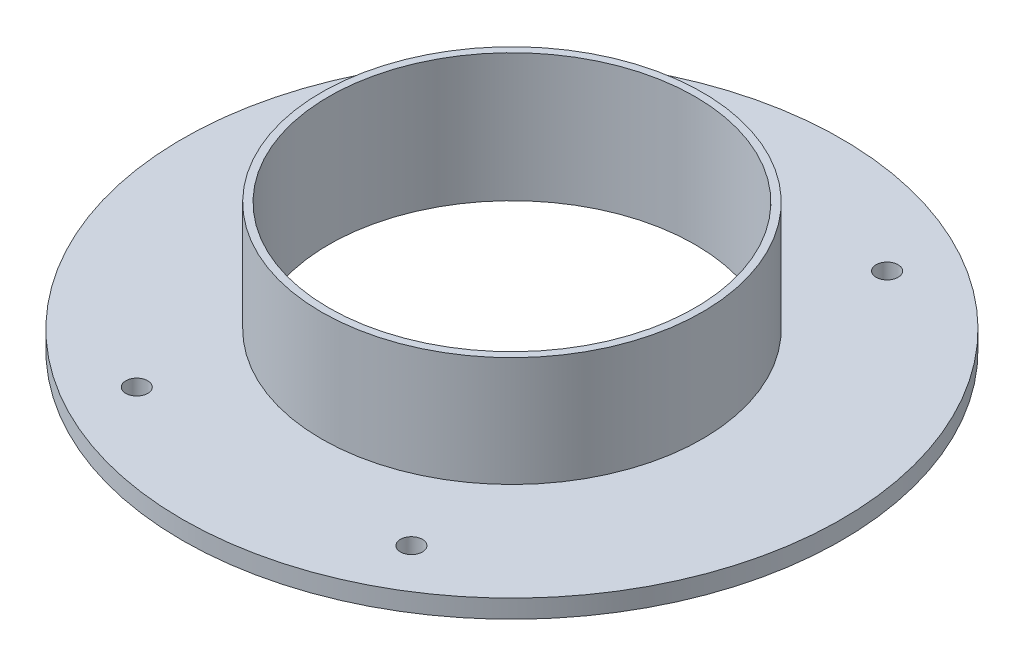
from build123d import *

# Parameters (mm, degrees)
SKETCH1_R           = 90
SKETCH1_R_2         = 50
SKETCH1_R_3         = 3
BOSS_EXTRUDE1_DEPTH = 5
SKETCH2_R           = 52
SKETCH2_R_2         = 50
BOSS_EXTRUDE2_DEPTH = 30


with BuildPart() as part:
    # Sketch1 → Boss-Extrude1 (new body)
    with BuildSketch(Plane(origin=(0, 0, 0), x_dir=(1, 0, 0), z_dir=(0, 1, 0))):
        with Locations(Location((0, 0, 0), (0, 0, 270))):
            Circle(SKETCH1_R)
        with Locations(Location((0, 0, 0), (0, 0, 270))):
            Circle(SKETCH1_R_2, mode=Mode.SUBTRACT)
        with Locations(Location((37.5, 64.951905284, 0), (0, 0, 270))):
            Circle(SKETCH1_R_3, mode=Mode.SUBTRACT)
        with Locations(Location((-37.5, 64.951905284, 0), (0, 0, 90))):
            Circle(SKETCH1_R_3, mode=Mode.SUBTRACT)
        with Locations(Location((37.5, -64.951905284, 0), (0, 0, 90))):
            Circle(SKETCH1_R_3, mode=Mode.SUBTRACT)
        with Locations(Location((-37.5, -64.951905284, 0), (0, 0, 270))):
            Circle(SKETCH1_R_3, mode=Mode.SUBTRACT)
    extrude(amount=BOSS_EXTRUDE1_DEPTH)

    # Sketch2 → Boss-Extrude2 (add)
    with BuildSketch(Plane(origin=(0, 5, 0), x_dir=(1, 0, 0), z_dir=(0, 1, 0))):
        with Locations(Location((0, 0, 0), (0, 0, 270))):
            Circle(SKETCH2_R)
        with Locations(Location((0, 0, 0), (0, 0, 270))):
            Circle(SKETCH2_R_2, mode=Mode.SUBTRACT)
    extrude(amount=BOSS_EXTRUDE2_DEPTH)


solid = part.part
